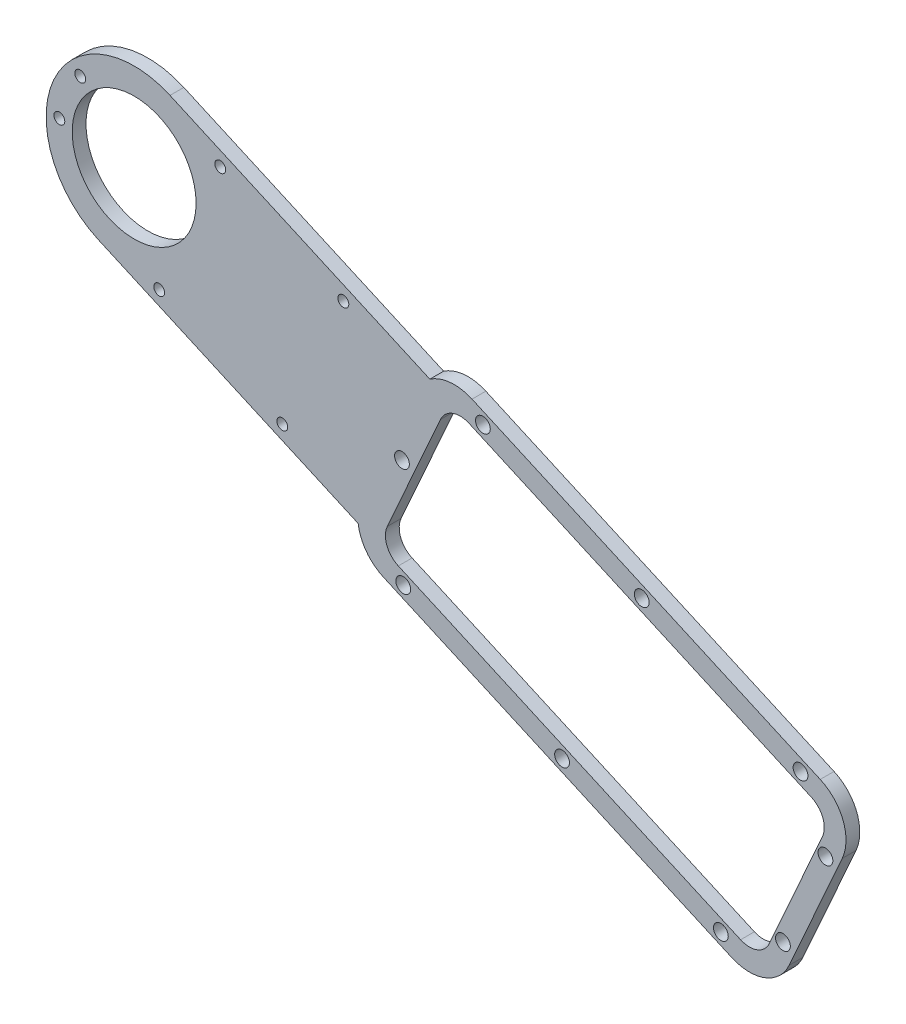
from build123d import *

# Parameters (mm, degrees)
SKETCH1_R           = 14.25
SKETCH1_R_2         = 1.7
BOSS_EXTRUDE1_DEPTH = 3.175
SKETCH5_R           = 1.25
CUT_EXTRUDE4_DEPTH  = 295.356841429
CUT_EXTRUDE5_DEPTH  = 10
FILLET1_R           = 5
FILLET2_R           = 5


with BuildPart() as part:
    # Sketch1 → Boss-Extrude1 (new body)
    with BuildSketch(Plane.XY):
        with BuildLine():
            Line((-72.715301765, 90.837326721), (-152.817002247, 126.544575004))
            ThreePointArc((-152.817002247, 126.544575004), (-157.784388135, 127.370762315), (-162.524605276, 125.671394934))
            Line((-162.524605276, 125.671394934), (-222.299360222, 152.317421212))
            ThreePointArc((-222.299360222, 152.317421212), (-249.039738928, 142.066706765), (-238.78902448, 115.326328059))
            Line((-238.78902448, 115.326328059), (-179.014269534, 88.680301782))
            ThreePointArc((-179.014269534, 88.680301782), (-177.109561802, 84.018800254), (-173.174612442, 80.876558766))
            Line((-173.174612442, 80.876558766), (-93.072911961, 45.169310483))
            ThreePointArc((-93.072911961, 45.169310483), (-85.421957972, 44.965480094), (-79.867786674, 50.231391692))
            Line((-79.867786674, 50.231391692), (-67.653220557, 77.632201435))
            ThreePointArc((-67.653220557, 77.632201435), (-67.449390168, 85.283155423), (-72.715301765, 90.837326721))
        make_face()
        with Locations((-230.544192351, 133.821874636)):
            Circle(SKETCH1_R, mode=Mode.SUBTRACT)
        with Locations((-95.571468701, 49.02024728)):
            Circle(SKETCH1_R_2, mode=Mode.SUBTRACT)
        with Locations((-132.105881692, 65.306335437)):
            Circle(SKETCH1_R_2, mode=Mode.SUBTRACT)
        with Locations((-168.640294682, 81.592423593)):
            Circle(SKETCH1_R_2, mode=Mode.SUBTRACT)
        with Locations((-150.318445506, 122.693638207)):
            Circle(SKETCH1_R_2, mode=Mode.SUBTRACT)
        with Locations((-113.784032516, 106.407550051)):
            Circle(SKETCH1_R_2, mode=Mode.SUBTRACT)
        with Locations((-77.249619525, 90.121461895)):
            Circle(SKETCH1_R_2, mode=Mode.SUBTRACT)
        with Locations((-81.295075004, 54.152214057)):
            Circle(SKETCH1_R_2, mode=Mode.SUBTRACT)
        with Locations((-71.52342211, 76.072861852)):
            Circle(SKETCH1_R_2, mode=Mode.SUBTRACT)
        with Locations((-168.932649456, 106.357056211)):
            Circle(SKETCH1_R_2, mode=Mode.SUBTRACT)
    extrude(amount=BOSS_EXTRUDE1_DEPTH)

    # Sketch5 → Cut-Extrude4 (cut, through all)
    with BuildSketch(Plane.XY.offset(3.175)):
        with Locations((-196.466353254, 99.744559857)):
            Circle(SKETCH5_R)
        with Locations((-224.780523322, 112.366278179)):
            Circle(SKETCH5_R)
        with Locations((-210.733772287, 143.877209383)):
            Circle(SKETCH5_R)
        with Locations((-182.419602219, 131.255491062)):
            Circle(SKETCH5_R)
        with Locations((-242.947351213, 145.810375386)):
            Circle(SKETCH5_R)
        with Locations((-247.751623016, 135.033002179)):
            Circle(SKETCH5_R)
    extrude(amount=-CUT_EXTRUDE4_DEPTH, mode=Mode.SUBTRACT)

    # Sketch6 → Cut-Extrude5 (cut)
    with BuildSketch(Plane.XY.offset(3.175)):
        Polygon((-158.059591703, 123.407293834), (-70.184261161, 84.234764078), (-86.470349317, 47.700351088), (-174.345679859, 86.872880843), align=None)
    extrude(amount=-CUT_EXTRUDE5_DEPTH, mode=Mode.SUBTRACT)

    # Fillet1
    fillet1_edges = [part.edges().sort_by_distance(p)[0] for p in [
        (-174.345679859, 86.872880843, 1.5875),
        (-158.059591703, 123.407293834, 1.5875),
    ]]
    fillet(fillet1_edges, radius=FILLET1_R)

    # Fillet2
    fillet2_edges = [part.edges().sort_by_distance(p)[0] for p in [
        (-70.184261161, 84.234764078, 1.5875),
        (-86.470349317, 47.700351088, 1.5875),
    ]]
    fillet(fillet2_edges, radius=FILLET2_R)


solid = part.part
